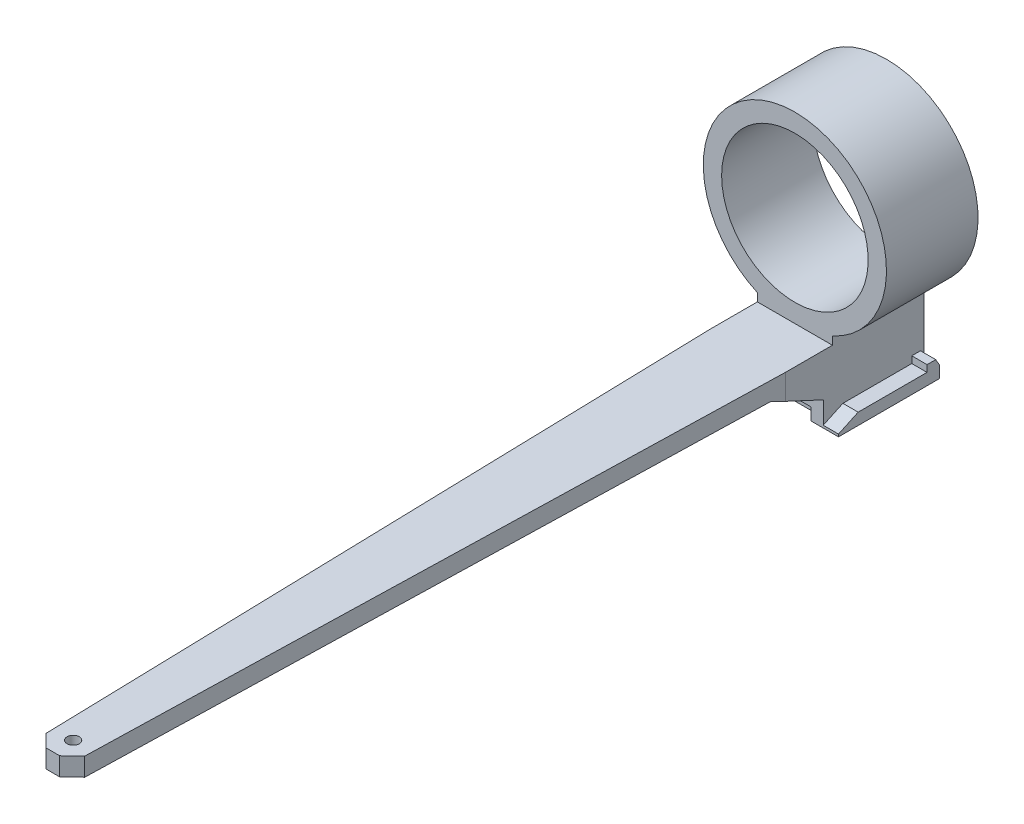
from build123d import *
from OCP.BRepFilletAPI import BRepFilletAPI_MakeChamfer

# Parameters (mm, degrees)
SKETCH1_W           = 17.5
SKETCH1_H           = 16.5
BOSS_EXTRUDE1_DEPTH = 3
SKETCH2_W           = 2.707061395
SKETCH2_H           = 1.1
SKETCH2_W_2         = 2.5
CUT_EXTRUDE1_DEPTH  = 14.5
CHAMFER1_SIZE       = 1.5
CHAMFER1_SIZE2      = 3.216760381
CHAMFER2_SIZE       = 1
CHAMFER2_SIZE2      = 0.577350269
SKETCH3_W           = 12.292938605
SKETCH3_H           = 15.922649731
BOSS_EXTRUDE2_DEPTH = 8
SKETCH4_W           = 12.292938605
SKETCH4_H           = 3
BOSS_EXTRUDE3_DEPTH = 120
CHAMFER3_SIZE       = 4
CHAMFER3_SIZE2      = 8.578027682
SKETCH5_W           = 12.292938605
SKETCH5_H           = 0.577350269
BOSS_EXTRUDE4_DEPTH = 10
SKETCH6_R           = 12
BOSS_EXTRUDE7_DEPTH = 15
CUT_EXTRUDE3_DEPTH  = 15
SKETCH10_R          = 1
CUT_EXTRUDE4_DEPTH  = 15
CHAMFER5_SIZE       = 2
CHAMFER5_SIZE2      = 2.054853594
SKETCH11_W          = 8.292938605
SKETCH11_H          = 2
CUT_EXTRUDE5_DEPTH  = 1.5


with BuildPart() as part:
    # Sketch1 → Boss-Extrude1 (new body)
    with BuildSketch(Plane(origin=(0, 0, 0), x_dir=(1, 0, 0), z_dir=(0, 1, 0))):
        with Locations((-7.963643791, 7.469362745)):
            Rectangle(SKETCH1_W, SKETCH1_H)
    extrude(amount=BOSS_EXTRUDE1_DEPTH)

    # Sketch2 → Cut-Extrude1 (cut)
    with BuildSketch(Plane.XY.offset(0.780637255)):
        with Locations((-15.360113094, 2.45)):
            Rectangle(SKETCH2_W, SKETCH2_H)
        with Locations((-0.463643791, 2.45)):
            Rectangle(SKETCH2_W_2, SKETCH2_H)
    extrude(amount=-CUT_EXTRUDE1_DEPTH, mode=Mode.SUBTRACT)

    # Chamfer1
    chamfer1_edges = [part.edges().sort_by_distance(p)[0] for p in [
        (-15.360113093, 1.9, 0.780637255),
        (-0.463643791, 1.9, 0.780637255),
    ]]
    chamfer1_side = [part.faces().sort_by_distance(p)[0] for p in [
        (-7.933712225, 1.383662189, 0.780637255),
    ]]
    chamfer(chamfer1_edges, length=CHAMFER1_SIZE, length2=CHAMFER1_SIZE2, reference=chamfer1_side[0])

    # Chamfer2
    chamfer2_edges = [part.edges().sort_by_distance(p)[0] for p in [
        (-7.963643791, 3, -15.719362745),
    ]]
    chamfer2_side = [part.faces().sort_by_distance(p)[0] for p in [
        (-7.963643791, 1.5, -15.719362745),
    ]]
    chamfer(chamfer2_edges, length=CHAMFER2_SIZE, length2=CHAMFER2_SIZE2, reference=chamfer2_side[0])

    # Sketch3 → Boss-Extrude2 (add)
    with BuildSketch(Plane(origin=(0, 3, 0), x_dir=(1, 0, 0), z_dir=(0, 1, 0))):
        with Locations((-7.860113094, 7.180687611)):
            Rectangle(SKETCH3_W, SKETCH3_H)
    extrude(amount=BOSS_EXTRUDE2_DEPTH)

    # Sketch4 → Boss-Extrude3 (add)
    with BuildSketch(Plane.XY.offset(0.780637255)):
        with Locations((-7.860113094, 9.5)):
            Rectangle(SKETCH4_W, SKETCH4_H)
    extrude(amount=BOSS_EXTRUDE3_DEPTH)

    # Chamfer3
    chamfer3_edges = [part.edges().sort_by_distance(p)[0] for p in [
        (-7.860113093, 8, 0.780637255),
    ]]
    chamfer3_side = [part.faces().sort_by_distance(p)[0] for p in [
        (-7.867329476, 3.921188666, 0.780637255),
    ]]
    chamfer(chamfer3_edges, length=CHAMFER3_SIZE, length2=CHAMFER3_SIZE2, reference=chamfer3_side[0])

    # Sketch5 → Boss-Extrude4 (add)
    with BuildSketch(Plane(origin=(0, 11, 0), x_dir=(1, 0, 0), z_dir=(0, 1, 0))):
        with Locations((-7.860113094, 15.430687611)):
            Rectangle(SKETCH5_W, SKETCH5_H)
    extrude(amount=-BOSS_EXTRUDE4_DEPTH)

    # Sketch6 → Boss-Extrude7 (add)
    with BuildSketch(Plane(origin=(0, 0, -15.719362745), x_dir=(-1, 0, 0), z_dir=(0, 0, -1))):
        with BuildLine():
            Line((1.713643791, 11), (14.006582396, 11))
            Line((14.006582396, 11), (14.006582396, 12.317130596))
            ThreePointArc((14.006582396, 12.317130596), (7.860113093, 41), (1.713643791, 12.317130596))
            Line((1.713643791, 12.317130596), (1.713643791, 11))
        make_face()
        with Locations((7.860113093, 26)):
            Circle(SKETCH6_R, mode=Mode.SUBTRACT)
    extrude(amount=-BOSS_EXTRUDE7_DEPTH)

    # Sketch7 → Cut-Extrude3 (cut)
    with BuildSketch(Plane(origin=(0, 11, 0), x_dir=(1, 0, 0), z_dir=(0, 1, 0))):
        Polygon((-11.006582396, -120.780637255), (-14.006582396, -6.957338355), (-14.006582396, -120.780637255), align=None)
        Polygon((-4.713643791, -120.780637255), (-1.713643791, -120.780637255), (-1.713643791, -6.957338355), align=None)
    extrude(amount=-CUT_EXTRUDE3_DEPTH, mode=Mode.SUBTRACT)

    # Sketch10 → Cut-Extrude4 (cut)
    with BuildSketch(Plane(origin=(0, 11, 0), x_dir=(1, 0, 0), z_dir=(0, 1, 0))):
        with Locations(Location((-7.860113093, -117.478934199, 0), (0, 0, 270))):
            Circle(SKETCH10_R)
    extrude(amount=-CUT_EXTRUDE4_DEPTH, mode=Mode.SUBTRACT)

    # Chamfer5: one chamfer whose edges measure the first distance from different faces: ONE call of the kernel's chamfer builder (chamfer() names one face for all edges)
    chamfer5_edges_1 = [part.edges().sort_by_distance(p)[0] for p in [
        (-11.006582396, 9.5, 120.780637255),
    ]]
    chamfer5_side_1 = [part.faces().sort_by_distance(p)[0] for p in [
        (-7.860113093, 9.5, 120.780637255),
    ]]
    chamfer5_edges_2 = [part.edges().sort_by_distance(p)[0] for p in [
        (-4.713643791, 9.5, 120.780637255),
    ]]
    chamfer5_side_2 = [part.faces().sort_by_distance(p)[0] for p in [
        (-3.207843821, 9.492653469, 63.64893058),
    ]]
    chamfer5 = BRepFilletAPI_MakeChamfer(part.part.solid().wrapped)
    for e in chamfer5_edges_1:
        chamfer5.Add(CHAMFER5_SIZE, CHAMFER5_SIZE2, e.wrapped, chamfer5_side_1[0].wrapped)  # the first distance lies on this face
    for e in chamfer5_edges_2:
        chamfer5.Add(CHAMFER5_SIZE, CHAMFER5_SIZE2, e.wrapped, chamfer5_side_2[0].wrapped)  # the first distance lies on this face
    add(Compound.cast(chamfer5.Shape()), mode=Mode.REPLACE)

    # Sketch11 → Cut-Extrude5 (cut)
    with BuildSketch(Plane.XY.offset(0.780637255)):
        with Locations((-7.860113094, 1)):
            Rectangle(SKETCH11_W, SKETCH11_H)
    extrude(amount=-CUT_EXTRUDE5_DEPTH, mode=Mode.SUBTRACT)


solid = part.part
